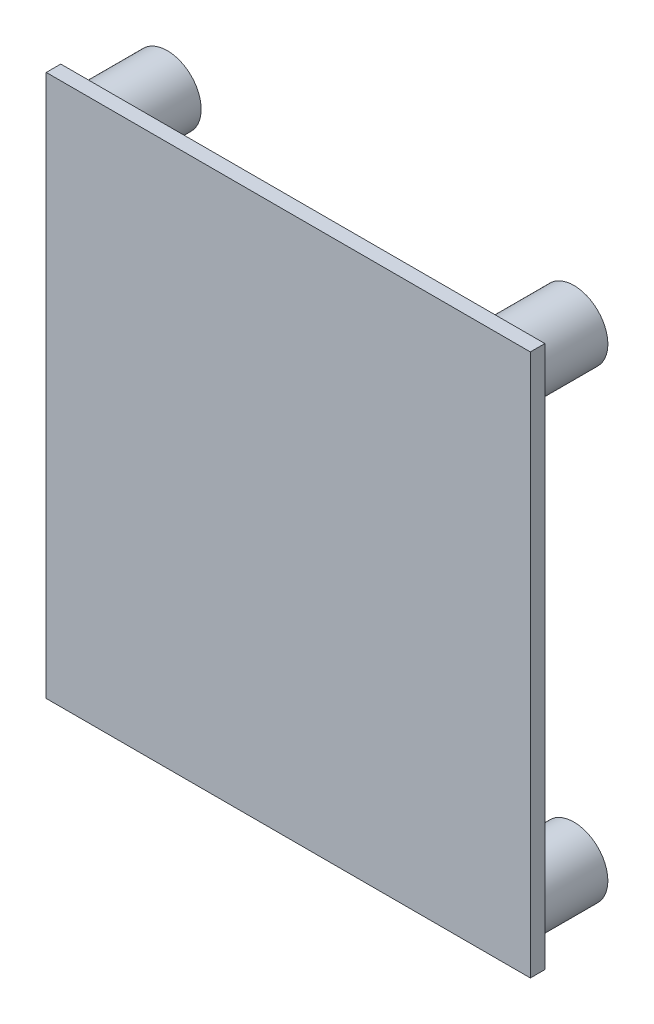
from build123d import *

# Parameters (mm, degrees)
SKETCH_1_W      = 50
SKETCH_1_H      = 56
EXTRUDE_1_DEPTH = 1.5
SKETCH_2_R      = 3.5
SKETCH_2_R_2    = 1.5
EXTRUDE_2_DEPTH = 7


with BuildPart() as part:
    # Эскиз1 → Бобышка-Вытянуть1 (new body)
    with BuildSketch(Plane.XY):
        with Locations((25, 28)):
            Rectangle(SKETCH_1_W, SKETCH_1_H)
    extrude(amount=EXTRUDE_1_DEPTH)

    # Эскиз2 → Бобышка-Вытянуть2 (add)
    # profile 1 of 4: a face of its own
    with BuildSketch(Plane(origin=(0, 0, 0), x_dir=(-1, 0, 0), z_dir=(0, 0, -1))):
        with Locations((-46, 52.2)):
            Circle(SKETCH_2_R)
        with Locations((-46, 52.2)):
            Circle(SKETCH_2_R_2, mode=Mode.SUBTRACT)
    # profile 2 of 4: a face of its own
    with BuildSketch(Plane(origin=(0, 0, 0), x_dir=(-1, 0, 0), z_dir=(0, 0, -1))):
        with Locations((-4, 52.2)):
            Circle(SKETCH_2_R)
        with Locations((-4, 52.2)):
            Circle(SKETCH_2_R_2, mode=Mode.SUBTRACT)
    # profile 3 of 4: a face of its own
    with BuildSketch(Plane(origin=(0, 0, 0), x_dir=(-1, 0, 0), z_dir=(0, 0, -1))):
        with Locations((-46, 4.2)):
            Circle(SKETCH_2_R)
        with Locations((-46, 4.2)):
            Circle(SKETCH_2_R_2, mode=Mode.SUBTRACT)
    # profile 4 of 4: a face of its own
    with BuildSketch(Plane(origin=(0, 0, 0), x_dir=(-1, 0, 0), z_dir=(0, 0, -1))):
        with Locations((-4, 4.2)):
            Circle(SKETCH_2_R)
        with Locations((-4, 4.2)):
            Circle(SKETCH_2_R_2, mode=Mode.SUBTRACT)
    extrude(amount=EXTRUDE_2_DEPTH)


solid = part.part
